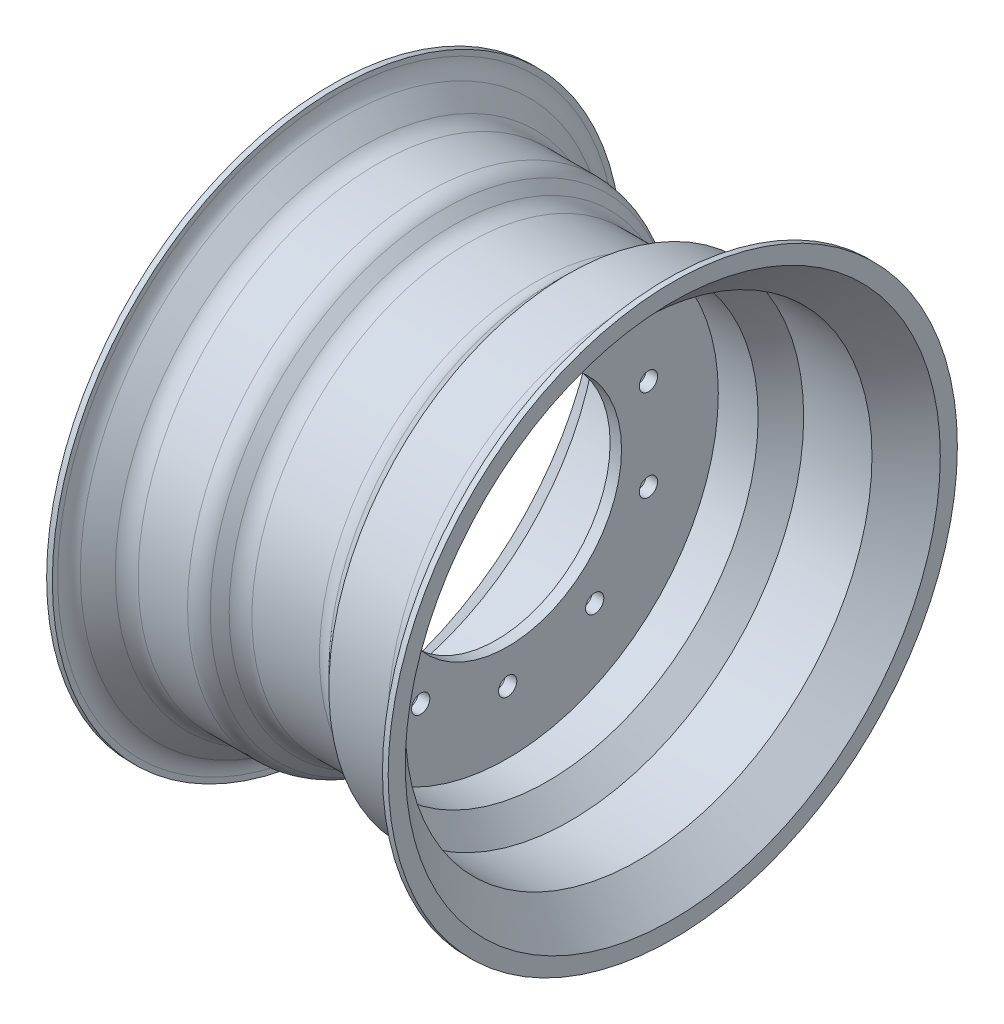
from build123d import *

# Parameters (mm, degrees)
FILLET1_R          = 20
SKETCH2_R          = 8
CUT_EXTRUDE1_DEPTH = 611
CIRPATTERN1_COUNT  = 10


with BuildPart() as part:
    # Sketch1 → Revolve1 (revolve)
    with BuildSketch(Plane.XY, mode=Mode.PRIVATE) as revolve1_sk:
        Polygon((-150, 250), (-150, 235), (-120, 205), (-60, 205), (-40, 185), (-5, 185), (-5, 100), (5, 100), (5, 185), (40, 185), (60, 205), (120, 205), (150, 235), (150, 250), (145, 250), (145, 237.071067812), (117.928932188, 210), (57.928932188, 210), (37.928932188, 190), (-37.928932188, 190), (-57.928932188, 210), (-117.928932188, 210), (-145, 237.071067812), (-145, 250), align=None)
    revolve(revolve1_sk.sketch.rotate(Axis((0, 0, 0), (-1, 0, 0)), 90), axis=Axis((0, 0, 0), (-1, 0, 0)))

    # Fillet1
    fillet1_edges = [part.edges().sort_by_distance(p)[0] for p in [
        (145, 0, 237.071067812),
        (117.928932188, 0, 210),
        (37.928932188, 0, 190),
        (-37.928932188, 0, 190),
        (-57.928932188, 0, 210),
        (-117.928932188, 0, 210),
        (-145, 0, 237.071067812),
    ]]
    fillet(fillet1_edges, radius=FILLET1_R)

    # Sketch2 → Cut-Extrude1 (cut)
    with BuildSketch(Plane(origin=(5, 0, 0), x_dir=(0, 0, -1), z_dir=(1, 0, 0))):
        with Locations((0, 130)):
            Circle(SKETCH2_R)
    cut_extrude1 = extrude(amount=-CUT_EXTRUDE1_DEPTH, mode=Mode.SUBTRACT)

    # CirPattern1: Cut-Extrude1 ×10 about axis
    cirpattern1_axis = Axis((0, 0, 0), (1, 0, 0))
    for i in range(1, CIRPATTERN1_COUNT):
        add(cut_extrude1.rotate(cirpattern1_axis, i * 360 / CIRPATTERN1_COUNT), mode=Mode.SUBTRACT)


solid = part.part
